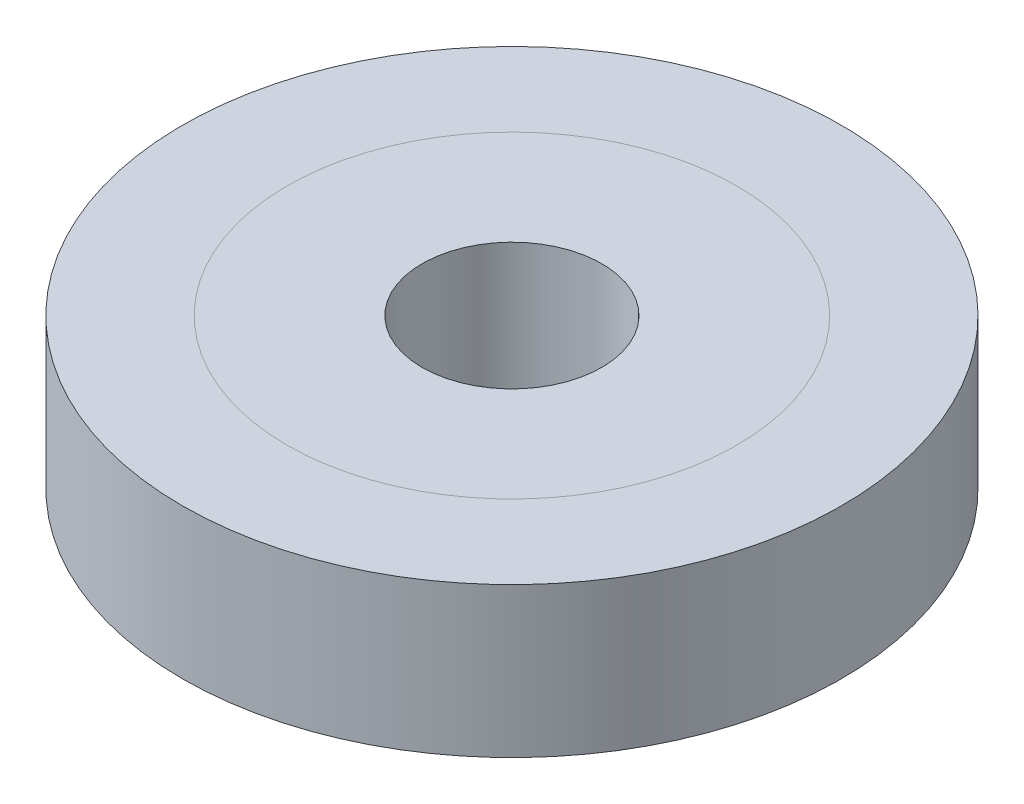
from build123d import *

# Parameters (mm, degrees)
SKETCH_1_R      = 7.5
SKETCH_1_R_2    = 3
EXTRUDE_1_DEPTH = 2.5
SKETCH_2_R      = 11
SKETCH_2_R_2    = 7.5
EXTRUDE_2_DEPTH = 2.5


with BuildPart() as part:
    # 草图1 → 凸台-拉伸1 (new, symmetric)
    with BuildSketch(Plane(origin=(0, 0, 0), x_dir=(1, 0, 0), z_dir=(0, 1, 0))):
        with Locations(Location((0, 0, 0), (0, 0, 270))):
            Circle(SKETCH_1_R)
        with Locations(Location((0, 0, 0), (0, 0, 270))):
            Circle(SKETCH_1_R_2, mode=Mode.SUBTRACT)
    extrude(amount=EXTRUDE_1_DEPTH, both=True)


with BuildPart() as body_2:
    # 草图2 → 凸台-拉伸2 (new, symmetric)
    with BuildSketch(Plane(origin=(0, 0, 0), x_dir=(1, 0, 0), z_dir=(0, 1, 0))):
        with Locations(Location((0, 0, 0), (0, 0, 270))):
            Circle(SKETCH_2_R)
        with Locations(Location((0, 0, 0), (0, 0, 270))):
            Circle(SKETCH_2_R_2, mode=Mode.SUBTRACT)
    extrude(amount=EXTRUDE_2_DEPTH, both=True)


solid = Compound([part.part, body_2.part])
